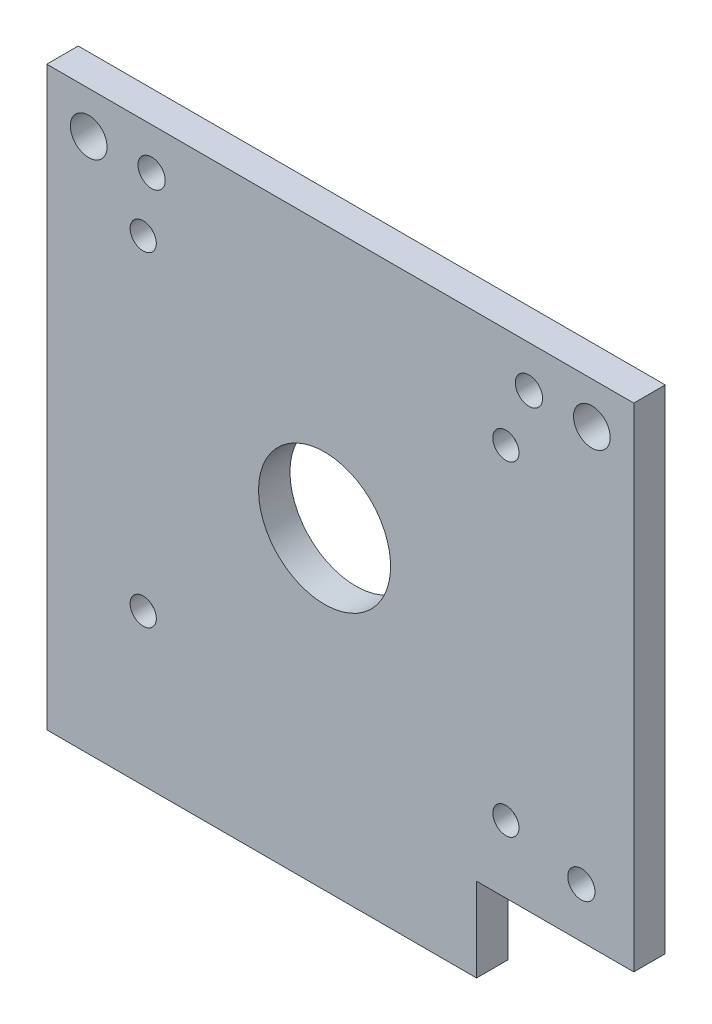
from build123d import *

# Parameters (mm, degrees)
CROQUIS1_W              = 56
CROQUIS1_H              = 55
SALIENTE_EXTRUIR1_DEPTH = 3
CROQUIS2_R              = 1.3
CROQUIS2_W              = 15
CROQUIS2_H              = 8
CROQUIS2_R_2            = 1.75
CORTAR_EXTRUIR1_DEPTH   = 4
CORTAR_EXTRUIR2_REACH   = 42.441
CROQUIS3_R              = 6.3
CROQUIS4_R              = 1.25
CORTAR_EXTRUIR3_DEPTH   = 10
CHAFL_N2_SIZE           = 1.25


with BuildPart() as part:
    # Croquis1 → Saliente-Extruir1 (new body)
    with BuildSketch(Plane.XY):
        with Locations((1.5, 0)):
            Rectangle(CROQUIS1_W, CROQUIS1_H)
    extrude(amount=SALIENTE_EXTRUIR1_DEPTH)

    # Croquis2 → Cortar-Extruir1 (cut)
    with BuildSketch(Plane.XY.offset(3)):
        with Locations((24.5, -14.75)):
            Circle(CROQUIS2_R)
        with Locations((22, -23.5)):
            Rectangle(CROQUIS2_W, CROQUIS2_H)
        with Locations((25.5, 23.528824725)):
            Circle(CROQUIS2_R_2)
        with Locations((19.5, 23.528824725)):
            Circle(CROQUIS2_R)
        with Locations((-22.5, 23.528824725)):
            Circle(CROQUIS2_R_2)
        with Locations((-16.5, 23.528824725)):
            Circle(CROQUIS2_R)
    extrude(amount=-CORTAR_EXTRUIR1_DEPTH, mode=Mode.SUBTRACT)

    # Croquis3 → Cortar-Extruir2 (cut, up to next)
    with BuildSketch(Plane(origin=(0, 0, 0), x_dir=(-1, 0, 0), z_dir=(0, 0, -1)), mode=Mode.PRIVATE) as cortar_extruir2_sk1:
        with Locations((0, 2.414991539)):
            Circle(CROQUIS3_R)
    cortar_extruir2_tool1 = extrude(cortar_extruir2_sk1.sketch, amount=-CORTAR_EXTRUIR2_REACH, mode=Mode.PRIVATE) & part.part
    add(cortar_extruir2_tool1.solids().sort_by_distance((0, 2.414992, 0))[0], mode=Mode.SUBTRACT)

    # Croquis4 → Cortar-Extruir3 (cut)
    with BuildSketch(Plane.XY.offset(3)):
        with Locations((-17.3, 17.914991539)):
            Circle(CROQUIS4_R)
        with Locations((17.3, 17.914991539)):
            Circle(CROQUIS4_R)
        with Locations((-17.3, -13.085008461)):
            Circle(CROQUIS4_R)
        with Locations((17.3, -13.085008461)):
            Circle(CROQUIS4_R)
    extrude(amount=-CORTAR_EXTRUIR3_DEPTH, mode=Mode.SUBTRACT)

    # Chaflán2
    chafl_n2_edges = [part.edges().sort_by_distance(p)[0] for p in [
        (16.05, 17.914991539, 0),
        (-18.55, -13.085008461, 0),
        (16.05, -13.085008461, 0),
        (-18.55, 17.914991539, 0),
    ]]
    chamfer(chafl_n2_edges, length=CHAFL_N2_SIZE)


solid = part.part
